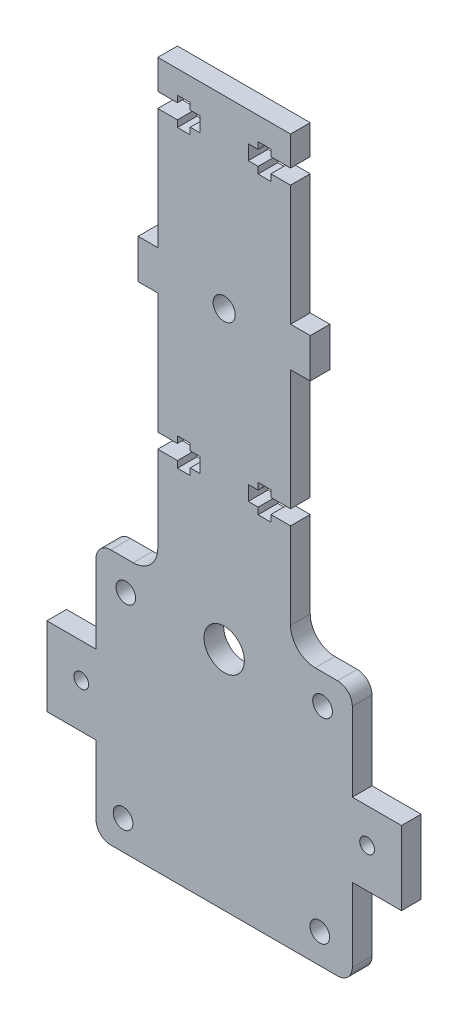
from build123d import *

# Parameters (mm, degrees)
SKETCH_1_R      = 2.25
SKETCH_1_R_2    = 2
SKETCH_1_R_3    = 4.1
SKETCH_1_R_4    = 1.5
EXTRUDE_1_DEPTH = 4


with BuildPart() as part:
    # 草图1 → 凸台-拉伸1 (new body)
    with BuildSketch(Plane.XY):
        with BuildLine():
            Line((0, -10.136956522), (-4, -10.136956522))
            Line((-4, -10.136956522), (-4, -2.136956522))
            Line((-4, -2.136956522), (0, -2.136956522))
            Line((0, -2.136956522), (0, 22.363043478))
            Line((0, 22.363043478), (4, 22.363043478))
            Line((4, 22.363043478), (4, 21.013043478))
            Line((4, 21.013043478), (6.6, 21.013043478))
            Line((6.6, 21.013043478), (6.6, 22.363043478))
            Line((6.6, 22.363043478), (8.6, 22.363043478))
            Line((8.6, 22.363043478), (8.6, 25.363043478))
            Line((8.6, 25.363043478), (6.6, 25.363043478))
            Line((6.6, 25.363043478), (6.6, 26.713043478))
            Line((6.6, 26.713043478), (4, 26.713043478))
            Line((4, 26.713043478), (4, 25.363043478))
            Line((4, 25.363043478), (0, 25.363043478))
            Line((0, 25.363043478), (0, 31.363043478))
            Line((0, 31.363043478), (27, 31.363043478))
            Line((27, 31.363043478), (27, 25.363043478))
            Line((27, 25.363043478), (23, 25.363043478))
            Line((23, 25.363043478), (23, 26.713043478))
            Line((23, 26.713043478), (20.4, 26.713043478))
            Line((20.4, 26.713043478), (20.4, 25.363043478))
            Line((20.4, 25.363043478), (18.4, 25.363043478))
            Line((18.4, 25.363043478), (18.4, 22.363043478))
            Line((18.4, 22.363043478), (20.4, 22.363043478))
            Line((20.4, 22.363043478), (20.4, 21.013043478))
            Line((20.4, 21.013043478), (23, 21.013043478))
            Line((23, 21.013043478), (23, 22.363043478))
            Line((23, 22.363043478), (27, 22.363043478))
            Line((27, 22.363043478), (27, -2.136956522))
            Line((27, -2.136956522), (31, -2.136956522))
            Line((31, -2.136956522), (31, -10.136956522))
            Line((31, -10.136956522), (27, -10.136956522))
            Line((27, -10.136956522), (27, -34.636956522))
            Line((27, -34.636956522), (23, -34.636956522))
            Line((23, -34.636956522), (23, -33.286956522))
            Line((23, -33.286956522), (20.4, -33.286956522))
            Line((20.4, -33.286956522), (20.4, -34.636956522))
            Line((20.4, -34.636956522), (18.4, -34.636956522))
            Line((18.4, -34.636956522), (18.4, -37.636956522))
            Line((18.4, -37.636956522), (20.4, -37.636956522))
            Line((20.4, -37.636956522), (20.4, -38.986956522))
            Line((20.4, -38.986956522), (23, -38.986956522))
            Line((23, -38.986956522), (23, -37.636956522))
            Line((23, -37.636956522), (27, -37.636956522))
            Line((27, -37.636956522), (27, -55.136956522))
            ThreePointArc((27, -55.136956522), (28.464466094, -58.672490428), (32, -60.136956522))
            Line((32, -60.136956522), (36.56, -60.136956522))
            ThreePointArc((36.56, -60.136956522), (38.681320344, -61.015636178), (39.56, -63.136956522))
            Line((39.56, -63.136956522), (39.56, -79.136956522))
            Line((39.56, -79.136956522), (49.56, -79.136956522))
            Line((49.56, -79.136956522), (49.56, -94.135010438))
            Line((49.56, -94.135010438), (39.56, -94.135010438))
            Line((39.56, -94.135010438), (39.56, -109.133064354))
            ThreePointArc((39.56, -109.133064354), (38.681320344, -111.254384698), (36.56, -112.133064354))
            Line((36.56, -112.133064354), (-9.56, -112.133064354))
            ThreePointArc((-9.56, -112.133064354), (-11.681320344, -111.254384698), (-12.56, -109.133064354))
            Line((-12.56, -109.133064354), (-12.56, -95.136956522))
            Line((-12.56, -95.136956522), (-22.56, -95.136956522))
            Line((-22.56, -95.136956522), (-22.56, -79.136956522))
            Line((-22.56, -79.136956522), (-12.56, -79.136956522))
            Line((-12.56, -79.136956522), (-12.56, -63.136956522))
            ThreePointArc((-12.56, -63.136956522), (-11.681320344, -61.015636178), (-9.56, -60.136956522))
            Line((-9.56, -60.136956522), (-5, -60.136956522))
            ThreePointArc((-5, -60.136956522), (-1.464466094, -58.672490428), (0, -55.136956522))
            Line((0, -55.136956522), (0, -37.636956522))
            Line((0, -37.636956522), (4, -37.636956522))
            Line((4, -37.636956522), (4, -38.986956522))
            Line((4, -38.986956522), (6.6, -38.986956522))
            Line((6.6, -38.986956522), (6.6, -37.636956522))
            Line((6.6, -37.636956522), (8.6, -37.636956522))
            Line((8.6, -37.636956522), (8.6, -34.636956522))
            Line((8.6, -34.636956522), (6.6, -34.636956522))
            Line((6.6, -34.636956522), (6.6, -33.286956522))
            Line((6.6, -33.286956522), (4, -33.286956522))
            Line((4, -33.286956522), (4, -34.636956522))
            Line((4, -34.636956522), (0, -34.636956522))
            Line((0, -34.636956522), (0, -10.136956522))
        make_face()
        with Locations((13.5, -6.136956522)):
            Circle(SKETCH_1_R, mode=Mode.SUBTRACT)
        with Locations((-6.5, -66.136956522)):
            Circle(SKETCH_1_R_2, mode=Mode.SUBTRACT)
        with Locations((-7.057994831, -106.133064354)):
            Circle(SKETCH_1_R_2, mode=Mode.SUBTRACT)
        with Locations((32.942005169, -106.133064354)):
            Circle(SKETCH_1_R_2, mode=Mode.SUBTRACT)
        with Locations((33.5, -66.136956522)):
            Circle(SKETCH_1_R_2, mode=Mode.SUBTRACT)
        with Locations((13.5, -66.136956522)):
            Circle(SKETCH_1_R_3, mode=Mode.SUBTRACT)
        with Locations((-15.56, -86.135010438)):
            Circle(SKETCH_1_R_4, mode=Mode.SUBTRACT)
        with Locations((42.56, -86.135010438)):
            Circle(SKETCH_1_R_4, mode=Mode.SUBTRACT)
    extrude(amount=EXTRUDE_1_DEPTH)


solid = part.part
